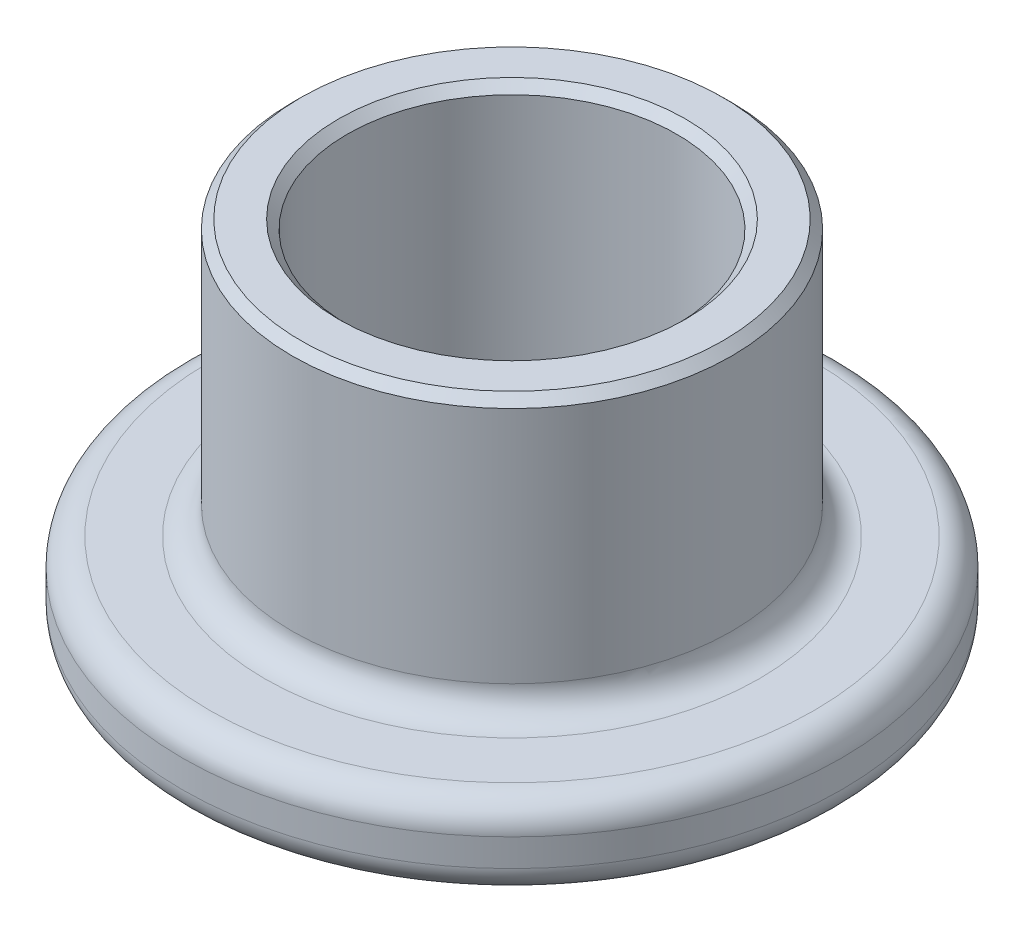
from build123d import *

# Parameters (mm, degrees)
FILLET1_R     = 0.396875
CHAMFER1_SIZE = 0.127


with BuildPart() as part:
    # Sketch1 → Revolve1 (revolve)
    with BuildSketch(Plane.XY, mode=Mode.PRIVATE) as revolve1_sk:
        Polygon((2.38125, 0), (4.7625, 0), (4.7625, 1.190625), (3.175, 1.190625), (3.175, 5.159375), (2.38125, 5.159375), align=None)
    revolve(revolve1_sk.sketch.rotate(Axis((0, 1.896667818, 0), (0, -1, 0)), 180), axis=Axis((0, 1.896667818, 0), (0, -1, 0)))

    # Fillet1
    fillet1_edges = [part.edges().sort_by_distance(p)[0] for p in [
        (3.175, 1.190625, 0),
        (4.7625, 1.190625, 0),
        (4.7625, 0, 0),
    ]]
    fillet(fillet1_edges, radius=FILLET1_R)

    # Chamfer1
    chamfer1_edges = [part.edges().sort_by_distance(p)[0] for p in [
        (2.38125, 5.159375, 0),
        (3.175, 5.159375, 0),
        (2.38125, 0, 0),
    ]]
    chamfer(chamfer1_edges, length=CHAMFER1_SIZE)


solid = part.part
